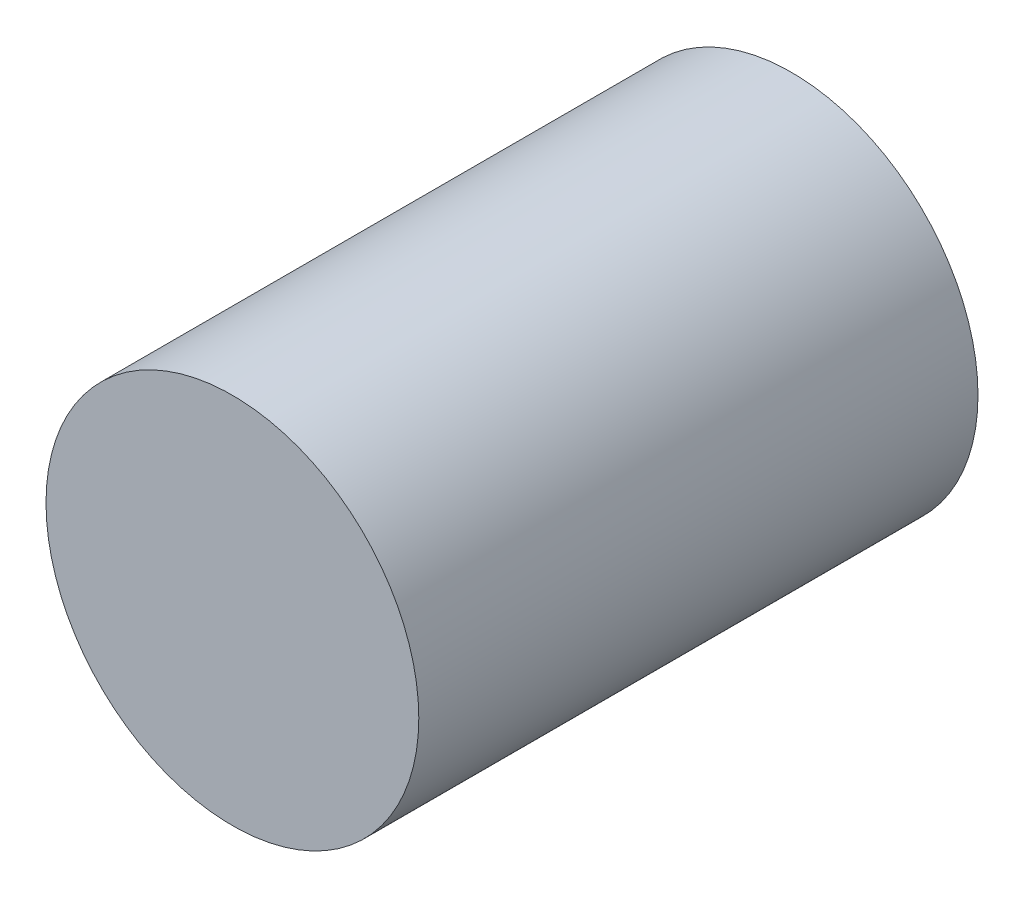
from build123d import *

# Parameters (mm, degrees)
SKETCH1_R           = 10
BOSS_EXTRUDE1_DEPTH = 15


with BuildPart() as part:
    # Sketch1 → Boss-Extrude1 (new, symmetric)
    with BuildSketch(Plane.XY):
        Circle(SKETCH1_R)
    extrude(amount=BOSS_EXTRUDE1_DEPTH, both=True)


solid = part.part
